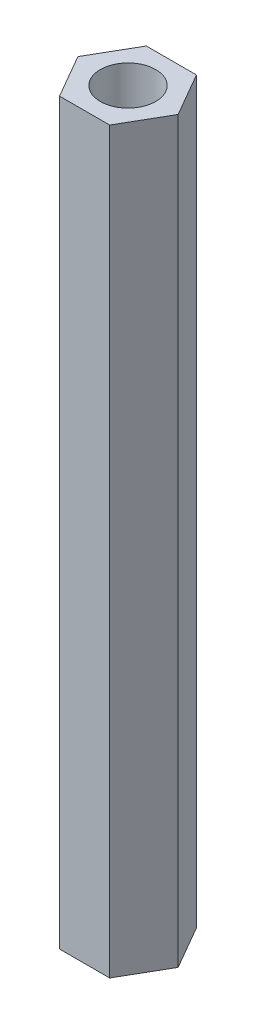
from build123d import *

# Parameters (mm, degrees)
SKETCH_1_R      = 1.5
EXTRUDE_1_DEPTH = 40


with BuildPart() as part:
    # 草图1 → 凸台-拉伸1 (new body)
    with BuildSketch(Plane(origin=(0, 0, 0), x_dir=(1, 0, 0), z_dir=(0, 1, 0))):
        Polygon((1.356773133, -2.35), (2.713546265, 0), (1.356773133, 2.35), (-1.356773133, 2.35), (-2.713546265, 0), (-1.356773133, -2.35), align=None)
        with Locations(Location((0, 0, 0), (0, 0, 270))):
            Circle(SKETCH_1_R, mode=Mode.SUBTRACT)
    extrude(amount=EXTRUDE_1_DEPTH)


solid = part.part
